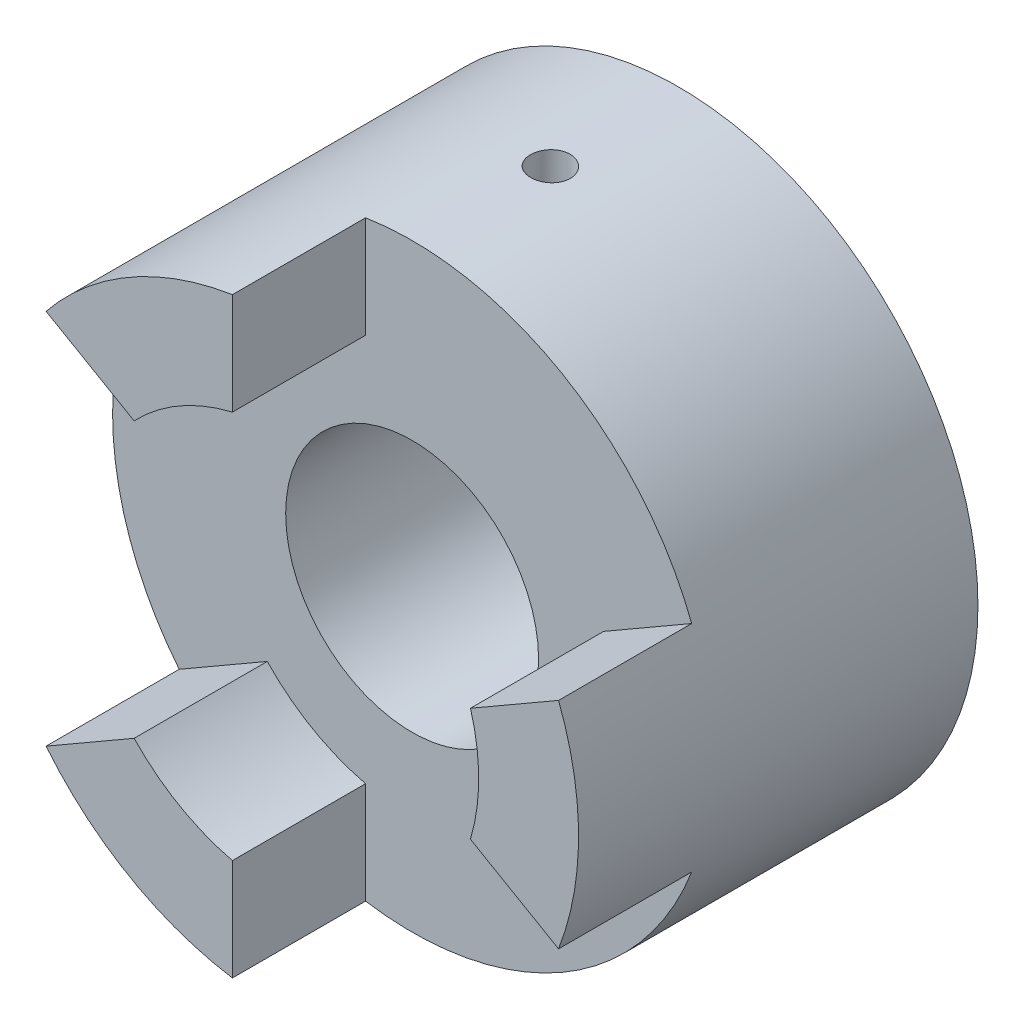
from build123d import *
from build123d.topology import SkipClean

# Parameters (mm, degrees)
SKETCH1_R                 = 22.5
BOSS_EXTRUDE1_DEPTH       = 20
CUT_EXTRUDE1_REACH        = 39.583
SKETCH3_R                 = 9.5
F_3_0MM_DOWEL_HOLE1_D     = 3
F_3_0MM_DOWEL_HOLE1_DEPTH = 22
F_3_0MM_DOWEL_HOLE1_TIP   = 0.901290929
BOSS_EXTRUDE3_DEPTH       = 10


with BuildPart() as part:
    # Sketch1 → Boss-Extrude1 (new body)
    with BuildSketch(Plane.XY):
        Circle(SKETCH1_R)
    extrude(amount=BOSS_EXTRUDE1_DEPTH)

    # Sketch3 → Cut-Extrude1 (cut, up to next)
    with BuildSketch(Plane.XY.offset(20), mode=Mode.PRIVATE) as cut_extrude1_sk1:
        Circle(SKETCH3_R)
    cut_extrude1_tool1 = extrude(cut_extrude1_sk1.sketch, amount=-CUT_EXTRUDE1_REACH, mode=Mode.PRIVATE) & part.part
    add(cut_extrude1_tool1.solids().sort_by_distance((0, 0, 20))[0], mode=Mode.SUBTRACT)

    # Ø3.0mm Dowel Hole1
    with Locations(Plane(origin=(0.332625349, 22.497541207, 9.950983977), x_dir=(0.999890720328, -0.014783348841, 0), z_dir=(0.014783348841, 0.999890720328, 0))):
        with Locations((0, 0)):
            Hole(F_3_0MM_DOWEL_HOLE1_D / 2, depth=F_3_0MM_DOWEL_HOLE1_DEPTH)
            with Locations((0, 0, -(F_3_0MM_DOWEL_HOLE1_DEPTH + F_3_0MM_DOWEL_HOLE1_TIP / 2))):  # 118° drill point
                Cone(0, F_3_0MM_DOWEL_HOLE1_D / 2, F_3_0MM_DOWEL_HOLE1_TIP, mode=Mode.SUBTRACT)

    # Sketch6 → Boss-Extrude3 (add)
    with SkipClean():  # the faces are left unmerged after this step: merging them gives an invalid solid
        with BuildSketch(Plane.XY.offset(20)):
            with BuildLine():
                Line((-17.498376555, 14.144144299), (-10.881805097, 10.324064986))
                ThreePointArc((-10.881805097, 10.324064986), (-7.5, 12.990381057), (-3.5, 14.585952146))
                Line((-3.5, 14.585952146), (-3.5, 22.226110771))
                ThreePointArc((-3.5, 22.226110771), (-11.25, 19.485571585), (-17.498376555, 14.144144299))
            make_face()
            with BuildLine():
                Line((14.381805097, 4.26188716), (20.998376555, 8.081966472))
                ThreePointArc((20.998376555, 8.081966472), (22.5, 0), (20.998376555, -8.081966472))
                Line((20.998376555, -8.081966472), (14.381805097, -4.26188716))
                ThreePointArc((14.381805097, -4.26188716), (15, 0), (14.381805097, 4.26188716))
            make_face()
            with BuildLine():
                Line((-3.5, -14.585952146), (-3.5, -22.226110771))
                ThreePointArc((-3.5, -22.226110771), (-11.25, -19.485571585), (-17.498376555, -14.144144299))
                Line((-17.498376555, -14.144144299), (-10.881805097, -10.324064986))
                ThreePointArc((-10.881805097, -10.324064986), (-7.5, -12.990381057), (-3.5, -14.585952146))
            make_face()
        extrude(amount=BOSS_EXTRUDE3_DEPTH)


solid = part.part
